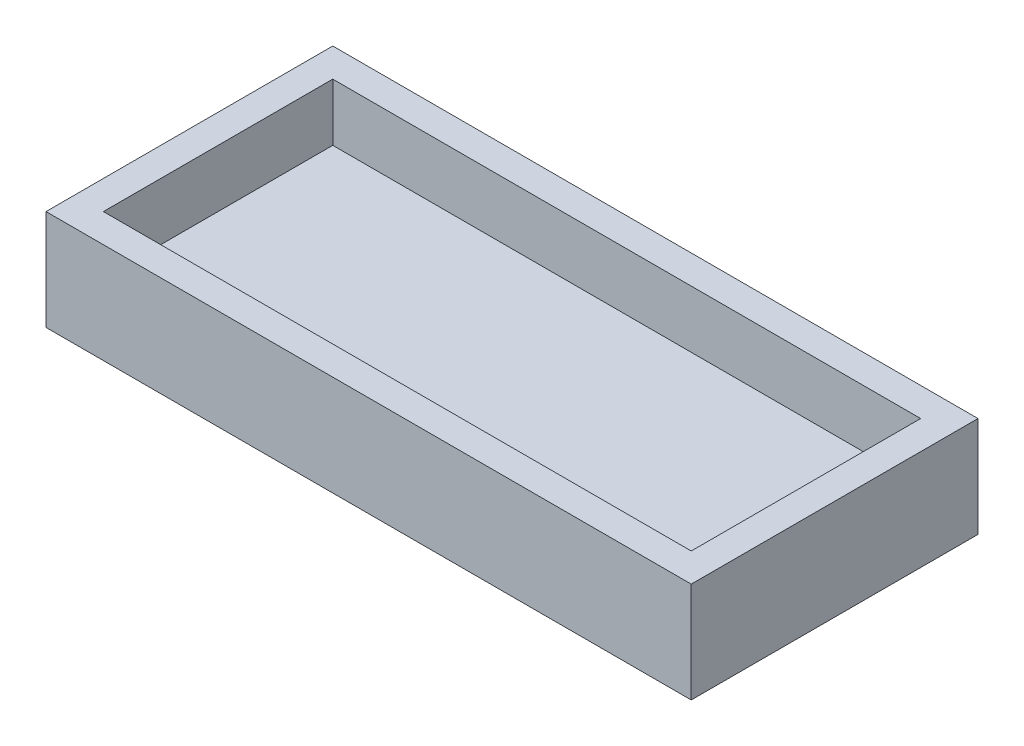
from build123d import *

# Parameters (mm, degrees)
SKETCH1_W           = 41
SKETCH1_H           = 16
BOSS_EXTRUDE1_DEPTH = 3
SKETCH2_W           = 45
SKETCH2_H           = 20
SKETCH2_W_2         = 41
SKETCH2_H_2         = 16
BOSS_EXTRUDE2_DEPTH = 7


with BuildPart() as part:
    # Sketch1 → Boss-Extrude1 (new body)
    with BuildSketch(Plane(origin=(0, 0, 0), x_dir=(1, 0, 0), z_dir=(0, 1, 0))):
        Rectangle(SKETCH1_W, SKETCH1_H)
    extrude(amount=BOSS_EXTRUDE1_DEPTH)

    # Sketch2 → Boss-Extrude2 (add)
    with BuildSketch(Plane.XZ):
        Rectangle(SKETCH2_W, SKETCH2_H)
        Rectangle(SKETCH2_W_2, SKETCH2_H_2, mode=Mode.SUBTRACT)
    extrude(amount=-BOSS_EXTRUDE2_DEPTH)


solid = part.part
